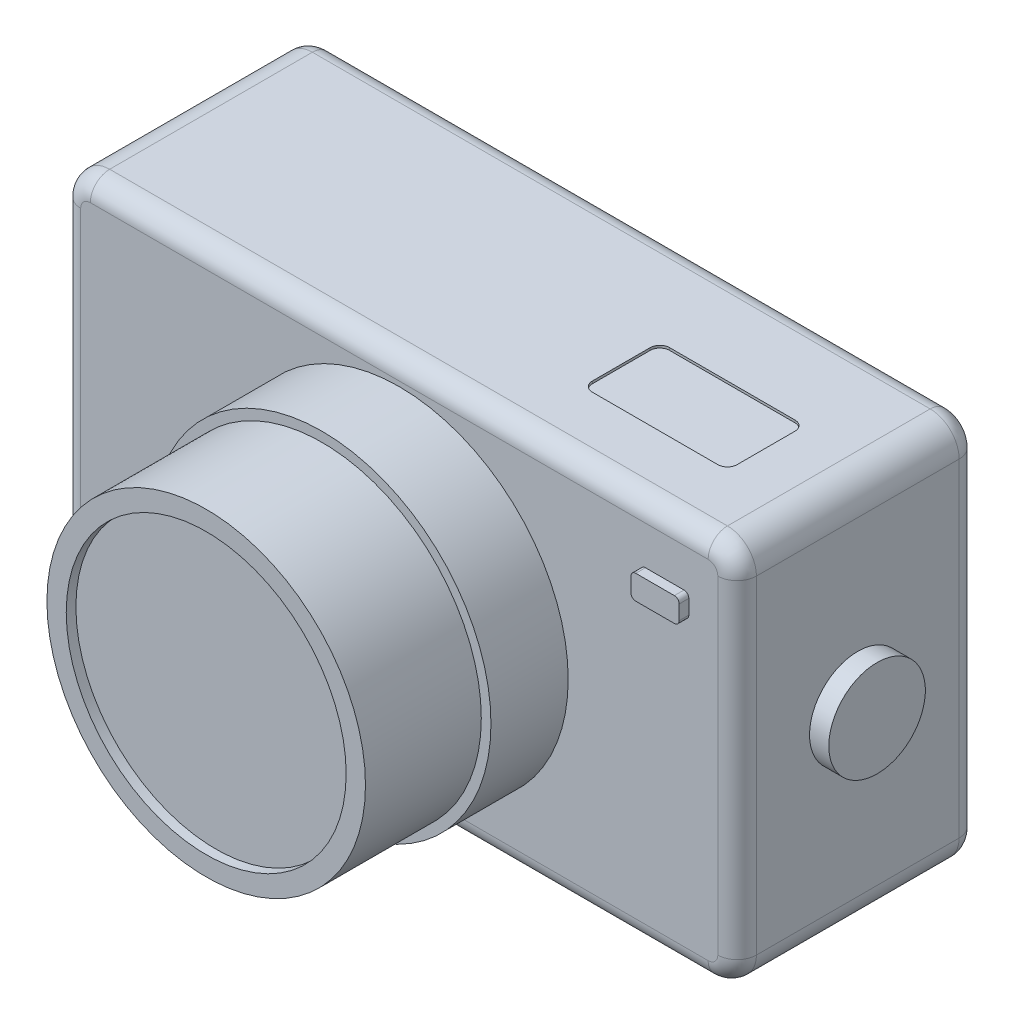
from build123d import *
from build123d.topology import SkipClean

# Parameters (mm, degrees)
BOSS_EXTRUDE1_DEPTH = 25
FILLET1_R           = 2
SKETCH2_R           = 17.5
BOSS_EXTRUDE2_DEPTH = 8
SKETCH3_R           = 16.5
BOSS_EXTRUDE3_DEPTH = 12
SKETCH4_R           = 14.5
CUT_EXTRUDE1_DEPTH  = 2
SKETCH5_R           = 16.5
BOSS_EXTRUDE4_DEPTH = 1
SKETCH6_R           = 2.5
CUT_EXTRUDE2_DEPTH  = 0.75
CUT_EXTRUDE3_DEPTH  = 0.5
CUT_EXTRUDE4_DEPTH  = 0.25
SKETCH11_R          = 5
BOSS_EXTRUDE5_DEPTH = 2
BOSS_EXTRUDE6_DEPTH = 1


with BuildPart() as part:
    # Sketch1 → Boss-Extrude1 (new body)
    with BuildSketch(Plane.XY):
        with BuildLine():
            Line((-32, -20), (32, -20))
            ThreePointArc((32, -20), (34.121320344, -19.121320344), (35, -17))
            Line((35, -17), (35, 17))
            ThreePointArc((35, 17), (34.121320344, 19.121320344), (32, 20))
            Line((32, 20), (-32, 20))
            ThreePointArc((-32, 20), (-34.121320344, 19.121320344), (-35, 17))
            Line((-35, 17), (-35, -17))
            ThreePointArc((-35, -17), (-34.121320344, -19.121320344), (-32, -20))
        make_face()
    extrude(amount=BOSS_EXTRUDE1_DEPTH)

    # Fillet1
    fillet1_edges = [part.edges().sort_by_distance(p)[0] for p in [
        (0, -20, 0),
        (-34.121320344, -19.121320344, 0),
        (-35, 0, 0),
        (-34.121320344, 19.121320344, 0),
        (-34.121320344, -19.121320344, 25),
        (0, -20, 25),
        (34.121320344, -19.121320344, 25),
        (35, 0, 25),
        (34.121320344, 19.121320344, 25),
        (0, 20, 25),
        (-34.121320344, 19.121320344, 25),
        (0, 20, 0),
        (-35, 0, 25),
        (34.121320344, 19.121320344, 0),
        (35, 0, 0),
        (34.121320344, -19.121320344, 0),
    ]]
    fillet(fillet1_edges, radius=FILLET1_R)

    # Sketch2 → Boss-Extrude2 (add)
    with BuildSketch(Plane.XY.offset(25)):
        with Locations(Location((0, 0, 0), (0, 0, 180))):
            Circle(SKETCH2_R)
    extrude(amount=BOSS_EXTRUDE2_DEPTH)

    # Sketch3 → Boss-Extrude3 (add)
    with BuildSketch(Plane.XY.offset(33)):
        Circle(SKETCH3_R)
    extrude(amount=BOSS_EXTRUDE3_DEPTH)

    # Sketch4 → Cut-Extrude1 (cut)
    with BuildSketch(Plane.XY.offset(45)):
        Circle(SKETCH4_R)
    extrude(amount=-CUT_EXTRUDE1_DEPTH, mode=Mode.SUBTRACT)

    # Sketch5 → Boss-Extrude4 (add)
    with BuildSketch(Plane.XY.offset(43)):
        Circle(SKETCH5_R)
    extrude(amount=BOSS_EXTRUDE4_DEPTH)

    # Sketch6 → Cut-Extrude2 (cut)
    with BuildSketch(Plane(origin=(0, 0, 0), x_dir=(-1, 0, 0), z_dir=(0, 0, -1))):
        with Locations((-25, 13.28125)):
            Circle(SKETCH6_R)
        with Locations(Location((25, 13.28125, 0), (0, 0, 180))):
            Circle(SKETCH6_R)
        with Locations((25, -13.28125)):
            Circle(SKETCH6_R)
        with Locations(Location((-25, -13.28125, 0), (0, 0, 180))):
            Circle(SKETCH6_R)
    extrude(amount=-CUT_EXTRUDE2_DEPTH, mode=Mode.SUBTRACT)

    # Sketch7 → Cut-Extrude3 (cut)
    with SkipClean():  # the faces are left unmerged after this step: merging them gives an invalid solid
        with BuildSketch(Plane(origin=(0, 0, 0.75), x_dir=(-1, 0, 0), z_dir=(0, 0, -1))):
            with BuildLine():
                Line((-24.6, 15.749042536), (-24.6, 13.68125))
                Line((-24.6, 13.68125), (-22.532207464, 13.68125))
                ThreePointArc((-22.532207464, 13.68125), (-22.5, 13.28125), (-22.532207464, 12.88125))
                Line((-22.532207464, 12.88125), (-24.6, 12.88125))
                Line((-24.6, 12.88125), (-24.6, 10.813457464))
                ThreePointArc((-24.6, 10.813457464), (-25, 10.78125), (-25.4, 10.813457464))
                Line((-25.4, 10.813457464), (-25.4, 12.88125))
                Line((-25.4, 12.88125), (-27.467792536, 12.88125))
                ThreePointArc((-27.467792536, 12.88125), (-27.5, 13.28125), (-27.467792536, 13.68125))
                Line((-27.467792536, 13.68125), (-25.4, 13.68125))
                Line((-25.4, 13.68125), (-25.4, 15.749042536))
                ThreePointArc((-25.4, 15.749042536), (-25, 15.78125), (-24.6, 15.749042536))
            make_face()
            with BuildLine():
                Line((25.4, 13.68125), (25.4, 15.749042536))
                ThreePointArc((25.4, 15.749042536), (25, 15.78125), (24.6, 15.749042536))
                Line((24.6, 15.749042536), (24.6, 13.68125))
                Line((24.6, 13.68125), (22.532207464, 13.68125))
                ThreePointArc((22.532207464, 13.68125), (22.5, 13.28125), (22.532207464, 12.88125))
                Line((22.532207464, 12.88125), (24.6, 12.88125))
                Line((24.6, 12.88125), (24.6, 10.813457464))
                ThreePointArc((24.6, 10.813457464), (25, 10.78125), (25.4, 10.813457464))
                Line((25.4, 10.813457464), (25.4, 12.88125))
                Line((25.4, 12.88125), (27.467792536, 12.88125))
                ThreePointArc((27.467792536, 12.88125), (27.5, 13.28125), (27.467792536, 13.68125))
                Line((27.467792536, 13.68125), (25.4, 13.68125))
            make_face()
            with BuildLine():
                Line((24.6, -15.749042536), (24.6, -13.68125))
                Line((24.6, -13.68125), (22.532207464, -13.68125))
                ThreePointArc((22.532207464, -13.68125), (22.5, -13.28125), (22.532207464, -12.88125))
                Line((22.532207464, -12.88125), (24.6, -12.88125))
                Line((24.6, -12.88125), (24.6, -10.813457464))
                ThreePointArc((24.6, -10.813457464), (25, -10.78125), (25.4, -10.813457464))
                Line((25.4, -10.813457464), (25.4, -12.88125))
                Line((25.4, -12.88125), (27.467792536, -12.88125))
                ThreePointArc((27.467792536, -12.88125), (27.5, -13.28125), (27.467792536, -13.68125))
                Line((27.467792536, -13.68125), (25.4, -13.68125))
                Line((25.4, -13.68125), (25.4, -15.749042536))
                ThreePointArc((25.4, -15.749042536), (25, -15.78125), (24.6, -15.749042536))
            make_face()
            with BuildLine():
                Line((-25.4, -13.68125), (-25.4, -15.749042536))
                ThreePointArc((-25.4, -15.749042536), (-25, -15.78125), (-24.6, -15.749042536))
                Line((-24.6, -15.749042536), (-24.6, -13.68125))
                Line((-24.6, -13.68125), (-22.532207464, -13.68125))
                ThreePointArc((-22.532207464, -13.68125), (-22.5, -13.28125), (-22.532207464, -12.88125))
                Line((-22.532207464, -12.88125), (-24.6, -12.88125))
                Line((-24.6, -12.88125), (-24.6, -10.813457464))
                ThreePointArc((-24.6, -10.813457464), (-25, -10.78125), (-25.4, -10.813457464))
                Line((-25.4, -10.813457464), (-25.4, -12.88125))
                Line((-25.4, -12.88125), (-27.467792536, -12.88125))
                ThreePointArc((-27.467792536, -12.88125), (-27.5, -13.28125), (-27.467792536, -13.68125))
                Line((-27.467792536, -13.68125), (-25.4, -13.68125))
            make_face()
        extrude(amount=-CUT_EXTRUDE3_DEPTH, mode=Mode.SUBTRACT)

    # Sketch8 → Cut-Extrude4 (cut)
    with SkipClean():  # the faces are left unmerged after this step: merging them gives an invalid solid
        with BuildSketch(Plane(origin=(0, 20, 0), x_dir=(1, 0, 0), z_dir=(0, 1, 0))):
            with BuildLine():
                Line((26, -18), (13, -18))
                ThreePointArc((13, -18), (12.292893219, -17.707106781), (12, -17))
                Line((12, -17), (12, -11))
                ThreePointArc((12, -11), (12.292893219, -10.292893219), (13, -10))
                Line((13, -10), (26, -10))
                ThreePointArc((26, -10), (26.707106781, -10.292893219), (27, -11))
                Line((27, -11), (27, -17))
                ThreePointArc((27, -17), (26.707106781, -17.707106781), (26, -18))
            make_face()
        extrude(amount=-CUT_EXTRUDE4_DEPTH, mode=Mode.SUBTRACT)

    # Sketch11 → Boss-Extrude5 (add)
    with SkipClean():  # the faces are left unmerged after this step: merging them gives an invalid solid
        with BuildSketch(Plane.ZY.offset(35)):
            with Locations(Location((12.5, 0, 0), (0, 0, 180))):
                Circle(SKETCH11_R)
        boss_extrude5 = extrude(amount=BOSS_EXTRUDE5_DEPTH)

    # Mirror1: Boss-Extrude5 across plane
    with SkipClean():  # the faces are left unmerged after this step: merging them gives an invalid solid
        add(boss_extrude5.mirror(Plane(origin=(0, 0, 0), x_dir=(0, 0, 1), z_dir=(1, 0, 0))))

    # Sketch12 → Boss-Extrude6 (add)
    with SkipClean():  # the faces are left unmerged after this step: merging them gives an invalid solid
        with BuildSketch(Plane.XY.offset(25)):
            with BuildLine():
                Line((25.5, 14), (29.5, 14))
                ThreePointArc((29.5, 14), (29.853553391, 13.853553391), (30, 13.5))
                Line((30, 13.5), (30, 12))
                ThreePointArc((30, 12), (29.853553391, 11.646446609), (29.5, 11.5))
                Line((29.5, 11.5), (25.5, 11.5))
                ThreePointArc((25.5, 11.5), (25.146446609, 11.646446609), (25, 12))
                Line((25, 12), (25, 13.5))
                ThreePointArc((25, 13.5), (25.146446609, 13.853553391), (25.5, 14))
            make_face()
        extrude(amount=BOSS_EXTRUDE6_DEPTH)


solid = part.part
